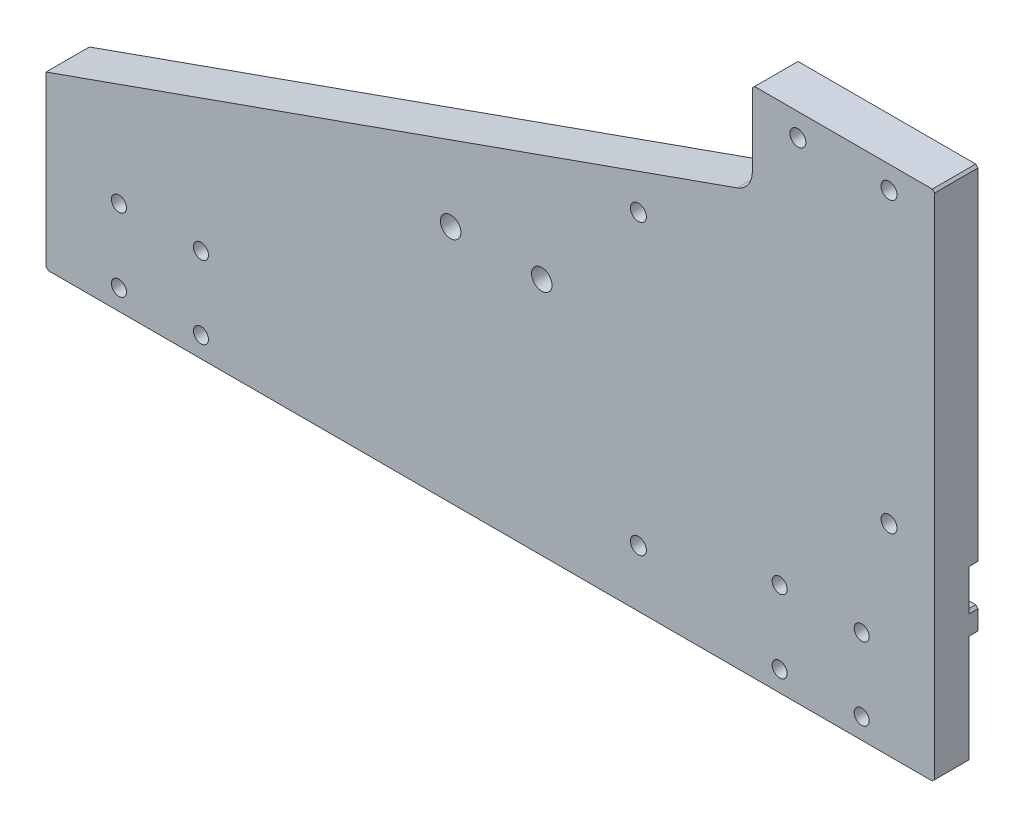
from build123d import *

# Parameters (mm, degrees)
BOSS_EXTRUDE1_DEPTH       = 19.05
SKETCH2_W                 = 390
SKETCH2_H                 = 47
SKETCH2_H_2               = 16
CUT_EXTRUDE2_DEPTH        = 4.05
M6_CLEARANCE_HOLE1_D      = 6.6
M6_CLEARANCE_HOLE2_D      = 6.6
M3X0_5_TAPPED_HOLE1_D     = 2.5
M3X0_5_TAPPED_HOLE1_DEPTH = 7.5
M3X0_5_TAPPED_HOLE1_TIP   = 0.751075774
M8X1_0_TAPPED_HOLE1_D     = 7
M8_CLEARANCE_HOLE1_D      = 9
FILLET1_R                 = 10
CHAMFER1_SIZE             = 1


with BuildPart() as part:
    # Sketch1 → Boss-Extrude1 (new body)
    with BuildSketch(Plane.XY):
        Polygon((-195, 50), (-195, -25), (195, -25), (195, 200), (115, 200), (115, 160), align=None)
    extrude(amount=BOSS_EXTRUDE1_DEPTH)

    # Sketch2 → Cut-Extrude2 (cut)
    with BuildSketch(Plane(origin=(0, 0, 0), x_dir=(-1, 0, 0), z_dir=(0, 0, -1))):
        with Locations((0, -1.5)):
            Rectangle(SKETCH2_W, SKETCH2_H)
        with Locations((0, 40.5)):
            Rectangle(SKETCH2_W, SKETCH2_H_2)
    extrude(amount=-CUT_EXTRUDE2_DEPTH, mode=Mode.SUBTRACT)

    # M6 Clearance Hole1 (through all)
    with Locations(Plane(origin=(0, 0, 4.05), x_dir=(-1, 0, 0), z_dir=(0, 0, -1))):
        with Locations((127, 16), (163, 16), (163, -16), (127, -16)):
            Hole(M6_CLEARANCE_HOLE1_D / 2)

    # M6 Clearance Hole2 (through all)
    with Locations(Plane(origin=(0, 0, 4.05), x_dir=(-1, 0, 0), z_dir=(0, 0, -1))):
        with Locations((-163, 16), (-127, 16), (-127, -16), (-163, -16)):
            Hole(M6_CLEARANCE_HOLE2_D / 2)

    # M3x0.5 Tapped Hole1
    with Locations(Plane(origin=(0, 0, 4.05), x_dir=(-1, 0, 0), z_dir=(0, 0, -1))):
        with Locations((-180, 42.5), (-160, 42.5), (180, 42.5), (160, 42.5)):
            Hole(M3X0_5_TAPPED_HOLE1_D / 2, depth=M3X0_5_TAPPED_HOLE1_DEPTH)
            with Locations((0, 0, -(M3X0_5_TAPPED_HOLE1_DEPTH + M3X0_5_TAPPED_HOLE1_TIP / 2))):  # 118° drill point
                Cone(0, M3X0_5_TAPPED_HOLE1_D / 2, M3X0_5_TAPPED_HOLE1_TIP, mode=Mode.SUBTRACT)

    # M8x1.0 Tapped Hole1 (through all)
    with Locations(Plane(origin=(0, 0, 0), x_dir=(-1, 0, 0), z_dir=(0, 0, -1))):
        with Locations((-175, 190), (-135, 190), (-65, 126.666666667), (-175, 63.333333333), (-65, 0)):
            Hole(M8X1_0_TAPPED_HOLE1_D / 2)

    # M8 Clearance Hole1 (through all)
    with Locations(Plane(origin=(0, 0, 0), x_dir=(-1, 0, 0), z_dir=(0, 0, -1))):
        with Locations((-22.6, 80), (17.4, 80)):
            Hole(M8_CLEARANCE_HOLE1_D / 2)

    # Fillet1
    fillet1_edges = [part.edges().sort_by_distance(p)[0] for p in [
        (115, 160, 9.525),
    ]]
    fillet(fillet1_edges, radius=FILLET1_R)

    # Chamfer1
    chamfer1_edges = [part.edges().sort_by_distance(p)[0] for p in [
        (115, 200, 9.525),
        (195, 200, 9.525),
        (195, -25, 11.55),
        (-195, -25, 11.55),
        (-195, 22, 2.025),
        (195, 22, 2.025),
        (-195, 32.5, 2.025),
        (-195, 48.5, 2.025),
        (195, 48.5, 2.025),
        (195, 32.5, 2.025),
    ]]
    chamfer(chamfer1_edges, length=CHAMFER1_SIZE)


solid = part.part
